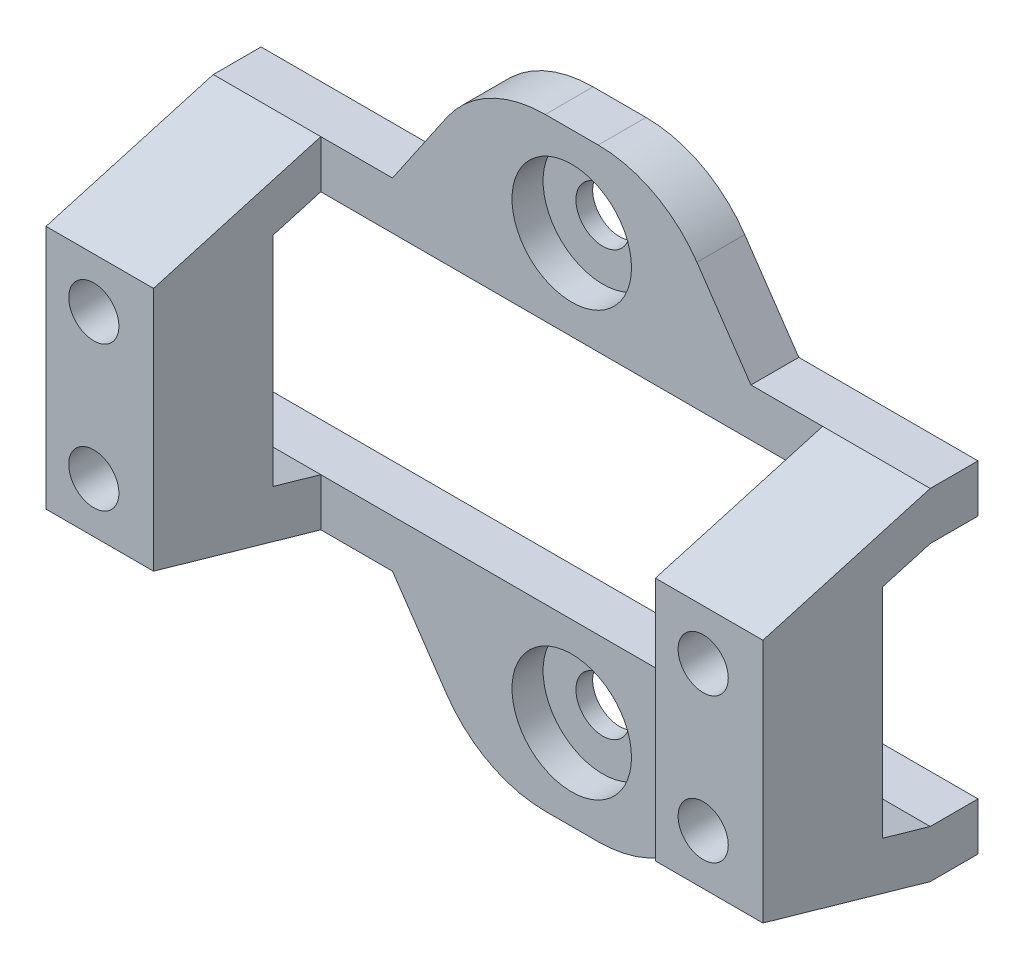
from build123d import *

# Parameters (mm, degrees)
ESTRUSIONE_ESTRUSIONE1_DEPTH                         = 4
ESTRUSIONE_ESTRUSIONE1_2_DEPTH                       = 4
ESTRUSIONE_ESTRUSIONE2_DEPTH                         = 9
ESTRUSIONE_ESTRUSIONE3_DEPTH                         = 9
RACCORDO1_R                                          = 10
FORO_LAMATO_PER_VITE_M4_A_TESTA_CILINDRI_D           = 4.5
FORO_LAMATO_PER_VITE_M4_A_TESTA_CILINDRI_DEPTH       = 34
FORO_LAMATO_PER_VITE_M4_A_TESTA_CILINDRI_CBORE_D     = 10
FORO_LAMATO_PER_VITE_M4_A_TESTA_CILINDRI_CBORE_DEPTH = 2.6
FORO_LAMATO_PER_VITE_M4_A_TESTA_CILINDRI_TIP         = 1.351936393
FORO_PER_VITE_M4_1_D                                 = 4.2
FORO_PER_VITE_M4_1_DEPTH                             = 8
FORO_PER_VITE_M4_1_TIP                               = 1.2618073


with BuildPart() as part:
    # Schizzo3 → Estrusione-Estrusione1 (new body)
    with BuildSketch(Plane.XY):
        Polygon((-30, 10.25), (30, 10.25), (30, 14.25), (15, 14.25), (7.5, 25.25), (-7.5, 25.25), (-15, 14.25), (-30, 14.25), align=None)
    extrude(amount=ESTRUSIONE_ESTRUSIONE1_DEPTH)



with BuildPart() as body_2:
    # Schizzo3 → Estrusione-Estrusione1 2 (new body)
    with BuildSketch(Plane.XY):
        Polygon((30, -10.25), (-30, -10.25), (-30, -14.25), (-15, -14.25), (-7.5, -25.25), (7.5, -25.25), (15, -14.25), (30, -14.25), align=None)
    extrude(amount=ESTRUSIONE_ESTRUSIONE1_2_DEPTH)


with BuildPart() as part_1:
    add(part.part)

    add(body_2.part)  # Estrusione-Estrusione2 merges body 2
    # Schizzo4 → Estrusione-Estrusione2 (add)
    with BuildSketch(Plane.ZY.offset(30)):
        Polygon((18, 10.25), (4, 14.25), (4, 10.25), (8, 9.107142857), (8, -9.107142857), (4, -10.25), (4, -14.25), (18, -10.25), align=None)
    extrude(amount=-ESTRUSIONE_ESTRUSIONE2_DEPTH)

    # Schizzo5 → Estrusione-Estrusione3 (add)
    with BuildSketch(Plane(origin=(30, 0, 0), x_dir=(0, 0, -1), z_dir=(1, 0, 0))):
        Polygon((-4, -14.25), (-18, -10.25), (-18, 10.25), (-4, 14.25), (-4, 10.25), (-8, 9.107142857), (-8, -9.107142857), (-4, -10.25), align=None)
    extrude(amount=-ESTRUSIONE_ESTRUSIONE3_DEPTH)

    # Raccordo1
    raccordo1_edges = [part_1.edges().sort_by_distance(p)[0] for p in [
        (-7.5, 25.25, 2),
        (7.5, 25.25, 2),
        (-7.5, -25.25, 2),
        (7.5, -25.25, 2),
    ]]
    fillet(raccordo1_edges, radius=RACCORDO1_R)

    # Foro lamato per Vite M4 a testa cilindrica piana-1
    with Locations(Plane.XY.offset(4)):
        with Locations((0, 17.75), (0, -17.75)):
            CounterBoreHole(FORO_LAMATO_PER_VITE_M4_A_TESTA_CILINDRI_D / 2, FORO_LAMATO_PER_VITE_M4_A_TESTA_CILINDRI_CBORE_D / 2, FORO_LAMATO_PER_VITE_M4_A_TESTA_CILINDRI_CBORE_DEPTH, depth=FORO_LAMATO_PER_VITE_M4_A_TESTA_CILINDRI_DEPTH)
            with Locations((0, 0, -(FORO_LAMATO_PER_VITE_M4_A_TESTA_CILINDRI_DEPTH + FORO_LAMATO_PER_VITE_M4_A_TESTA_CILINDRI_TIP / 2))):  # 118° drill point
                Cone(0, FORO_LAMATO_PER_VITE_M4_A_TESTA_CILINDRI_D / 2, FORO_LAMATO_PER_VITE_M4_A_TESTA_CILINDRI_TIP, mode=Mode.SUBTRACT)

    # Foro per Vite M4-1
    with Locations(Plane.XY.offset(18)):
        with Locations((-26, -6.05), (25, 6.05), (25, -6.05), (-26, 6.05)):
            Hole(FORO_PER_VITE_M4_1_D / 2, depth=FORO_PER_VITE_M4_1_DEPTH)
            with Locations((0, 0, -(FORO_PER_VITE_M4_1_DEPTH + FORO_PER_VITE_M4_1_TIP / 2))):  # 118° drill point
                Cone(0, FORO_PER_VITE_M4_1_D / 2, FORO_PER_VITE_M4_1_TIP, mode=Mode.SUBTRACT)


solid = part_1.part
